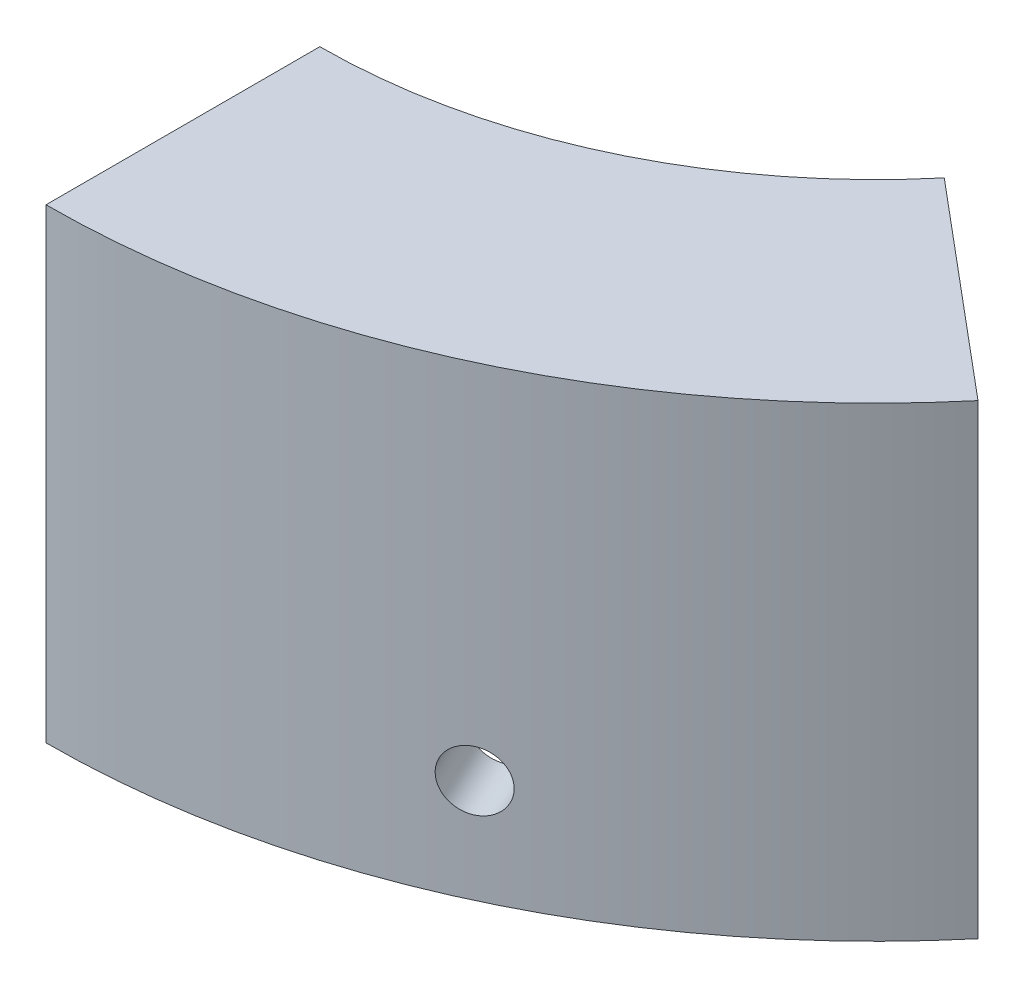
from build123d import *

# Parameters (mm, degrees)
BOSS_EXTRUDE1_DEPTH   = 6.25
BOSS_EXTRUDE2_DEPTH   = 5
BOSS_EXTRUDE3_START   = 28.7
BOSS_EXTRUDE3_DEPTH   = 28.7
SKETCH4_R             = 2.15
M4_THROUGH_HOLE_DEPTH = 47.541927843


with BuildPart() as part:
    # Sketch1 → Boss-Extrude1 (new body)
    with BuildSketch(Plane(origin=(0, 0, 0), x_dir=(1, 0, 0), z_dir=(0, 1, 0))):
        with BuildLine():
            ThreePointArc((33.093119943, -27.768424738), (18.257108907, -39.1524964), (0, -43.2))
            Line((0, -43.2), (0, -46.8))
            ThreePointArc((0, -46.8), (19.778534649, -42.415204433), (35.850879938, -30.082460133))
            Line((35.850879938, -30.082460133), (33.093119943, -27.768424738))
        make_face()
    extrude(amount=BOSS_EXTRUDE1_DEPTH)

    # Sketch2 → Boss-Extrude2 (add)
    with BuildSketch(Plane(origin=(0, 6.25, 0), x_dir=(1, 0, 0), z_dir=(0, 1, 0))):
        with BuildLine():
            ThreePointArc((35.850879938, -30.082460133), (19.778534649, -42.415204433), (0, -46.8))
            Line((0, -46.8), (0, -60))
            ThreePointArc((0, -60), (25.357095704, -54.378467222), (45.962666587, -38.567256581))
            Line((45.962666587, -38.567256581), (35.850879938, -30.082460133))
        make_face()
        with BuildLine():
            Line((35.850879938, -30.082460133), (33.093119943, -27.768424738))
            ThreePointArc((33.093119943, -27.768424738), (18.257108907, -39.1524964), (0, -43.2))
            Line((0, -43.2), (0, -46.8))
            ThreePointArc((0, -46.8), (19.778534649, -42.415204433), (35.850879938, -30.082460133))
        make_face()
        with BuildLine():
            ThreePointArc((30.794986613, -25.840061909), (16.989254122, -36.433573039), (0, -40.2))
            Line((0, -40.2), (0, -43.2))
            ThreePointArc((0, -43.2), (18.257108907, -39.1524964), (33.093119943, -27.768424738))
            Line((33.093119943, -27.768424738), (30.794986613, -25.840061909))
        make_face()
    extrude(amount=BOSS_EXTRUDE2_DEPTH)

    # Sketch3 → Boss-Extrude3 (add)
    with BuildSketch(Plane(origin=(0, 6.25, 0), x_dir=(-1, 0, 0), z_dir=(0, -1, 0)).offset(BOSS_EXTRUDE3_START)):
        with BuildLine():
            ThreePointArc((0, -55.2), (-23.328528048, -50.028189844), (-42.28565326, -35.481876055))
            Line((-42.28565326, -35.481876055), (-45.962666587, -38.567256581))
            ThreePointArc((-45.962666587, -38.567256581), (-25.357095704, -54.378467222), (0, -60))
            Line((0, -60), (0, -55.2))
        make_face()
    extrude(amount=-BOSS_EXTRUDE3_DEPTH)

    # Sketch4 → M4-through hole (cut, through all)
    with BuildSketch(Plane(origin=(15.397493307, 0, 33.020030955), x_dir=(0.9063077870366493, 0, -0.42261826174070105), z_dir=(0.42261826174070105, 0, 0.9063077870366493))):
        with Locations(Location((0, -14.95, 0), (0, 0, 180))):
            Circle(SKETCH4_R)
    extrude(amount=M4_THROUGH_HOLE_DEPTH, mode=Mode.SUBTRACT)


solid = part.part
